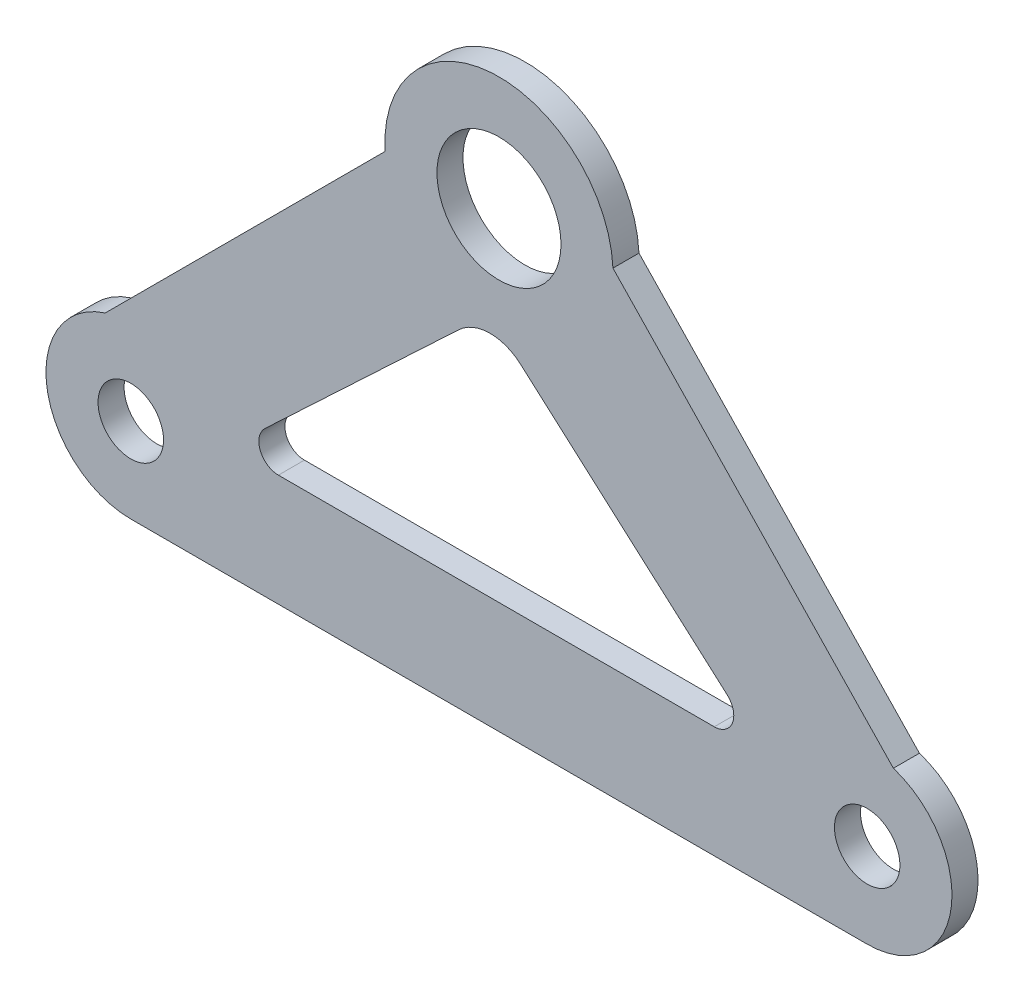
from build123d import *

# Parameters (mm, degrees)
SKETCH_1_R          = 9.53
SKETCH_1_R_2        = 5.03
EXTRUDE_1_DEPTH     = 4
CUT_EXTRUDE_1_DEPTH = 10


with BuildPart() as part:
    # 草图1 → 凸台-拉伸1 (new body)
    with BuildSketch(Plane.XY):
        with BuildLine():
            Line((-60.484665535, -44.140957036), (-17.492328922, -1.148620423))
            ThreePointArc((-17.492328922, -1.148620423), (-0.984866816, 17.502312343), (17.510762826, 0.821026949))
            Line((17.510762826, 0.821026949), (60.595126742, -44.176306244))
            ThreePointArc((60.595126742, -44.176306244), (69.43811394, -58.606931767), (56.568542495, -69.598542495))
            Line((56.568542495, -69.598542495), (-56.568542495, -69.598542495))
            ThreePointArc((-56.568542495, -69.598542495), (-69.447058297, -58.549635813), (-60.484665535, -44.140957036))
        make_face()
        Circle(SKETCH_1_R, mode=Mode.SUBTRACT)
        with Locations((-56.568542495, -56.568542495)):
            Circle(SKETCH_1_R_2, mode=Mode.SUBTRACT)
        with Locations((56.568542495, -56.568542495)):
            Circle(SKETCH_1_R_2, mode=Mode.SUBTRACT)
    extrude(amount=EXTRUDE_1_DEPTH)

    # 草图2 → 切除-拉伸1 (cut)
    with BuildSketch(Plane.XY.offset(4)):
        with BuildLine():
            Line((-35.944637397, -47.236581954), (-6.146065042, -19.193110209))
            ThreePointArc((-6.146065042, -19.193110209), (-1.455267075, -17.291512681), (3.291241318, -19.049442373))
            Line((3.291241318, -19.049442373), (35.061663803, -47.175010024))
            ThreePointArc((35.061663803, -47.175010024), (35.878352511, -50.484569716), (33.073110812, -52.421264017))
            Line((33.073110812, -52.421264017), (-33.888630519, -52.421264017))
            ThreePointArc((-33.888630519, -52.421264017), (-36.677361968, -50.527146879), (-35.944637397, -47.236581954))
        make_face()
    extrude(amount=-CUT_EXTRUDE_1_DEPTH, mode=Mode.SUBTRACT)


solid = part.part
